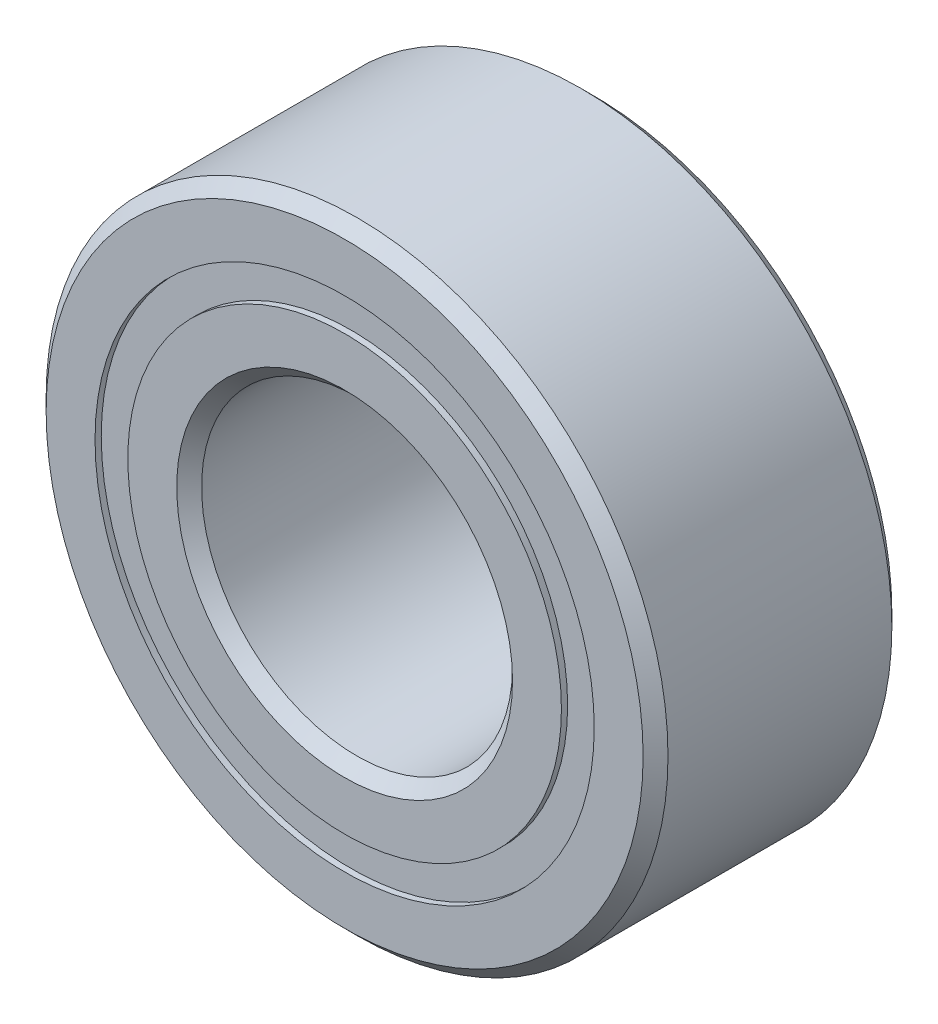
from build123d import *

# Parameters (mm, degrees)
CIRPATTERN1_COUNT = 12
SKETCH5_W         = 0.972810551
SKETCH5_H         = 0.527472528


with BuildPart() as part:
    # Sketch1 → Revolve1 (revolve)
    with BuildSketch(Plane(origin=(0, 0, 0), x_dir=(0, 0, -1), z_dir=(1, 0, 0)), mode=Mode.PRIVATE) as revolve1_sk:
        with BuildLine():
            Line((1.8, 5), (-1.8, 5))
            Line((-1.8, 5), (-2, 4.8))
            Line((-2, 4.8), (-2, 4.013736264))
            Line((-2, 4.013736264), (-0.888888889, 4.013736264))
            ThreePointArc((-0.888888889, 4.013736264), (0, 4.677189449), (0.888888889, 4.013736264))
            Line((0.888888889, 4.013736264), (2, 4.013736264))
            Line((2, 4.013736264), (2, 4.8))
            Line((2, 4.8), (1.8, 5))
        make_face()
    revolve(revolve1_sk.sketch.rotate(Axis((0, 0, 2), (0, 0, -1)), 90), axis=Axis((0, 0, 2), (0, 0, -1)))


with BuildPart() as body_2:
    # Sketch3 → Revolve3 (revolve)
    with BuildSketch(Plane(origin=(0, 0, 0), x_dir=(0, 0, -1), z_dir=(1, 0, 0)), mode=Mode.PRIVATE) as revolve3_sk:
        with BuildLine():
            Line((-2, 3.486263736), (-0.888888889, 3.486263736))
            ThreePointArc((-0.888888889, 3.486263736), (0, 2.822810551), (0.888888889, 3.486263736))
            Line((0.888888889, 3.486263736), (2, 3.486263736))
            Line((2, 3.486263736), (2, 2.7))
            Line((2, 2.7), (1.8, 2.5))
            Line((1.8, 2.5), (-1.8, 2.5))
            Line((-1.8, 2.5), (-2, 2.7))
            Line((-2, 2.7), (-2, 3.486263736))
        make_face()
    revolve(revolve3_sk.sketch.rotate(Axis((0, 0, 2), (0, 0, -1)), 90), axis=Axis((0, 0, 2), (0, 0, -1)))


with BuildPart() as body_3:
    # Sketch4 → Revolve4 (revolve)
    with BuildSketch(Plane(origin=(0, 0, 0), x_dir=(0, 0, -1), z_dir=(1, 0, 0))):
        with BuildLine():
            Line((-0.927189449, 3.75), (0.927189449, 3.75))
            ThreePointArc((0.927189449, 3.75), (0, 4.677189449), (-0.927189449, 3.75))
        make_face()
    revolve(axis=Axis((0, 3.75, 0.927189449), (0, 0, -1)))


with BuildPart() as cirpattern1_1:
    # CirPattern1: pattern copy
    add(body_3.part.rotate(Axis((0, 0, 0), (0, 0, 1)), 1 * 360 / CIRPATTERN1_COUNT))


with BuildPart() as cirpattern1_2:
    # CirPattern1: pattern copy
    add(body_3.part.rotate(Axis((0, 0, 0), (0, 0, 1)), 2 * 360 / CIRPATTERN1_COUNT))


with BuildPart() as cirpattern1_3:
    # CirPattern1: pattern copy
    add(body_3.part.rotate(Axis((0, 0, 0), (0, 0, 1)), 3 * 360 / CIRPATTERN1_COUNT))


with BuildPart() as cirpattern1_4:
    # CirPattern1: pattern copy
    add(body_3.part.rotate(Axis((0, 0, 0), (0, 0, 1)), 4 * 360 / CIRPATTERN1_COUNT))


with BuildPart() as cirpattern1_5:
    # CirPattern1: pattern copy
    add(body_3.part.rotate(Axis((0, 0, 0), (0, 0, 1)), 5 * 360 / CIRPATTERN1_COUNT))


with BuildPart() as cirpattern1_6:
    # CirPattern1: pattern copy
    add(body_3.part.rotate(Axis((0, 0, 0), (0, 0, 1)), 6 * 360 / CIRPATTERN1_COUNT))


with BuildPart() as cirpattern1_7:
    # CirPattern1: pattern copy
    add(body_3.part.rotate(Axis((0, 0, 0), (0, 0, 1)), 7 * 360 / CIRPATTERN1_COUNT))


with BuildPart() as cirpattern1_8:
    # CirPattern1: pattern copy
    add(body_3.part.rotate(Axis((0, 0, 0), (0, 0, 1)), 8 * 360 / CIRPATTERN1_COUNT))


with BuildPart() as cirpattern1_9:
    # CirPattern1: pattern copy
    add(body_3.part.rotate(Axis((0, 0, 0), (0, 0, 1)), 9 * 360 / CIRPATTERN1_COUNT))


with BuildPart() as cirpattern1_10:
    # CirPattern1: pattern copy
    add(body_3.part.rotate(Axis((0, 0, 0), (0, 0, 1)), 10 * 360 / CIRPATTERN1_COUNT))


with BuildPart() as cirpattern1_11:
    # CirPattern1: pattern copy
    add(body_3.part.rotate(Axis((0, 0, 0), (0, 0, 1)), 11 * 360 / CIRPATTERN1_COUNT))


with BuildPart() as body_15:
    # Sketch5 → Revolve5 (revolve)
    with BuildSketch(Plane(origin=(0, 0, 0), x_dir=(0, 0, -1), z_dir=(1, 0, 0)), mode=Mode.PRIVATE) as revolve5_sk:
        with Locations((-1.413594725, 3.75)):
            Rectangle(SKETCH5_W, SKETCH5_H)
        with Locations((1.413594725, 3.75)):
            Rectangle(SKETCH5_W, SKETCH5_H)
    revolve(revolve5_sk.sketch.rotate(Axis((0, 0, 2), (0, 0, -1)), 90), axis=Axis((0, 0, 2), (0, 0, -1)))


solid = Compound([part.part, body_2.part, body_3.part, cirpattern1_1.part, cirpattern1_2.part, cirpattern1_3.part, cirpattern1_4.part, cirpattern1_5.part, cirpattern1_6.part, cirpattern1_7.part, cirpattern1_8.part, cirpattern1_9.part, cirpattern1_10.part, cirpattern1_11.part, body_15.part])
